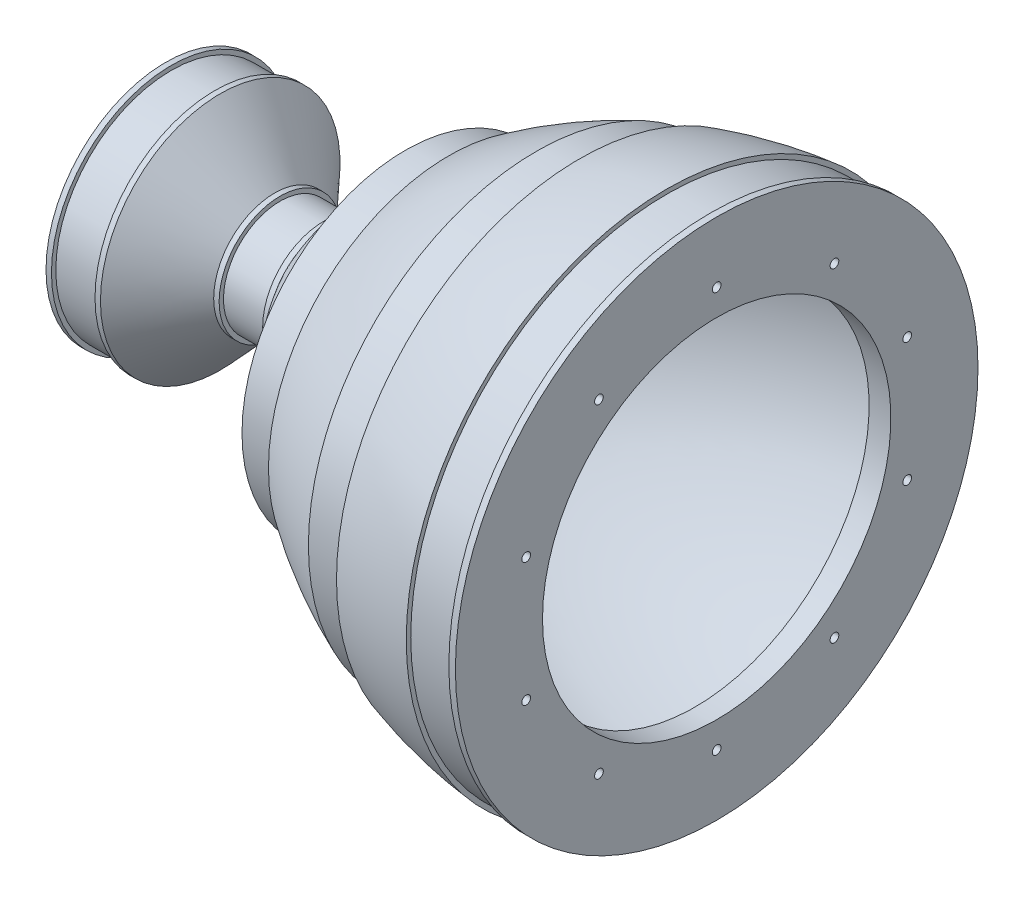
from build123d import *

# Parameters (mm, degrees)
SKETCH2_R          = 2
CUT_EXTRUDE1_DEPTH = 10
SKETCH3_R          = 2
CUT_EXTRUDE2_DEPTH = 10


with BuildPart() as part:
    # Sketch1 → Revolve1 (revolve)
    with BuildSketch(Plane.XY, mode=Mode.PRIVATE) as revolve1_sk:
        with BuildLine():
            Line((-13.547676843, 80), (-3.547676843, 80))
            Line((-3.547676843, 80), (-3.547676843, 120))
            Line((-3.547676843, 120), (-6.547676843, 120))
            Line((-6.547676843, 120), (-6.547676843, 117.5))
            Line((-6.547676843, 117.5), (-26.547676843, 117.5))
            Line((-26.547676843, 117.5), (-26.547676843, 119.563264874))
            ThreePointArc((-26.547676843, 119.563264874), (-46.73701782, 116.53049781), (-66.547676843, 111.59643719))
            Line((-66.547676843, 111.59643719), (-66.547676843, 104.5))
            Line((-66.547676843, 104.5), (-86.547676843, 104.5))
            ThreePointArc((-86.547676843, 104.5), (-107.122168132, 94.730106924), (-126.547676843, 82.838508469))
            Line((-126.547676843, 82.838508469), (-126.547676843, 75))
            Line((-126.547676843, 75), (-146.547676843, 75))
            Line((-146.547676843, 75), (-146.547676843, 67.275434145))
            ThreePointArc((-146.547676843, 67.275434145), (-165.253477075, 48.712256642), (-181.547676843, 28))
            Line((-181.547676843, 28), (-184.047676843, 28))
            Line((-184.047676843, 28), (-184.047676843, 26))
            Line((-184.047676843, 26), (-204.047676843, 26))
            Line((-204.047676843, 26), (-204.047676843, 28))
            Line((-204.047676843, 28), (-206.547676843, 28))
            Line((-206.547676843, 28), (-231.547676843, 55))
            Line((-231.547676843, 55), (-234.047676843, 55))
            Line((-234.047676843, 55), (-234.047676843, 53))
            Line((-234.047676843, 53), (-254.047676843, 53))
            Line((-254.047676843, 53), (-254.047676843, 55))
            Line((-254.047676843, 55), (-256.547676843, 55))
            Line((-256.547676843, 55), (-256.547676843, 30))
            Line((-256.547676843, 30), (-246.547676843, 30))
            Line((-246.547676843, 30), (-246.547676843, 45.820294157))
            Line((-246.547676843, 45.820294157), (-236.547676843, 45.820294157))
            Line((-236.547676843, 45.820294157), (-212.639997068, 20))
            Line((-212.639997068, 20), (-175.547676843, 20))
            ThreePointArc((-175.547676843, 20), (-105.298190774, 84.350925075), (-13.547676843, 110))
            Line((-13.547676843, 110), (-13.547676843, 80))
        make_face()
    revolve(revolve1_sk.sketch.rotate(Axis((-129.761904762, 0, 0), (1, 0, 0)), 90), axis=Axis((-129.761904762, 0, 0), (1, 0, 0)))

    # Sketch2 → Cut-Extrude1 (cut)
    with BuildSketch(Plane(origin=(-3.547676843, 0, 0), x_dir=(0, 0, -1), z_dir=(1, 0, 0))):
        with Locations((0, 92)):
            Circle(SKETCH2_R)
        with Locations((54.076243211, 74.429563482)):
            Circle(SKETCH2_R)
        with Locations((87.497199499, 28.429563482)):
            Circle(SKETCH2_R)
        with Locations((87.497199499, -28.429563482)):
            Circle(SKETCH2_R)
        with Locations((54.076243211, -74.429563482)):
            Circle(SKETCH2_R)
        with Locations((0, -92)):
            Circle(SKETCH2_R)
        with Locations((-54.076243211, -74.429563482)):
            Circle(SKETCH2_R)
        with Locations((-87.497199499, -28.429563482)):
            Circle(SKETCH2_R)
        with Locations((-87.497199499, 28.429563482)):
            Circle(SKETCH2_R)
        with Locations((-54.076243211, 74.429563482)):
            Circle(SKETCH2_R)
    extrude(amount=-CUT_EXTRUDE1_DEPTH, mode=Mode.SUBTRACT)

    # Sketch3 → Cut-Extrude2 (cut)
    with BuildSketch(Plane.ZY.offset(256.547676843)):
        with Locations((0, 47.5)):
            Circle(SKETCH3_R)
        with Locations((27.919799484, 38.428307233)):
            Circle(SKETCH3_R)
        with Locations((45.175184524, 14.678307233)):
            Circle(SKETCH3_R)
        with Locations((45.175184524, -14.678307233)):
            Circle(SKETCH3_R)
        with Locations((27.919799484, -38.428307233)):
            Circle(SKETCH3_R)
        with Locations((0, -47.5)):
            Circle(SKETCH3_R)
        with Locations((-27.919799484, -38.428307233)):
            Circle(SKETCH3_R)
        with Locations((-45.175184524, -14.678307233)):
            Circle(SKETCH3_R)
        with Locations((-45.175184524, 14.678307233)):
            Circle(SKETCH3_R)
        with Locations((-27.919799484, 38.428307233)):
            Circle(SKETCH3_R)
    extrude(amount=-CUT_EXTRUDE2_DEPTH, mode=Mode.SUBTRACT)


solid = part.part
